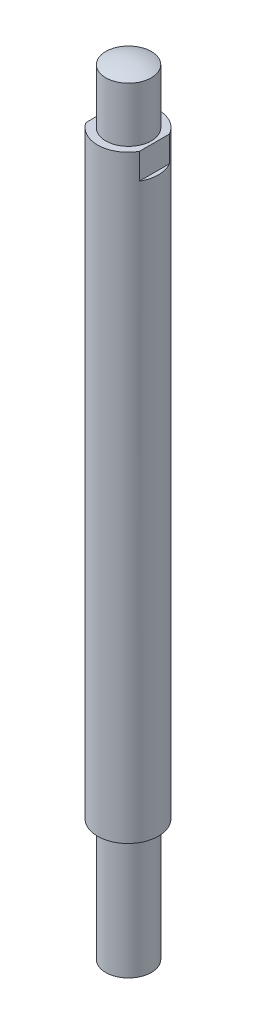
from build123d import *

# Parameters (mm, degrees)
SKETCH1_R           = 20
SKETCH1_R_2         = 15
BOSS_EXTRUDE1_DEPTH = 394
BOSS_EXTRUDE2_START = 394
SKETCH1_2_R         = 15
BOSS_EXTRUDE2_DEPTH = 36
SKETCH1_3_R         = 15
BOSS_EXTRUDE3_DEPTH = 80
CUT_EXTRUDE1_START  = 377
CUT_EXTRUDE1_DEPTH  = 17
DOME8_FACE_RADIUS   = 15
DOME8_HEIGHT        = 3
DOME9_FACE_RADIUS   = 15
DOME9_HEIGHT        = 3


with BuildPart() as part:
    # Sketch1 → Boss-Extrude1 (new body)
    with BuildSketch(Plane(origin=(0, 0, 0), x_dir=(1, 0, 0), z_dir=(0, 1, 0))):
        with Locations(Location((-0.371790911, 0, 0), (0, 0, 270))):
            Circle(SKETCH1_R)
        with Locations(Location((0, 0, 0), (0, 0, 270))):
            Circle(SKETCH1_R_2, mode=Mode.SUBTRACT)
    extrude(amount=BOSS_EXTRUDE1_DEPTH)

    # Sketch2 → Cut-Extrude1 (cut)
    with BuildSketch(Plane(origin=(0, 0, 0), x_dir=(1, 0, 0), z_dir=(0, 1, 0)).offset(CUT_EXTRUDE1_START)):
        with BuildLine():
            Line((-17, 11.113175176), (-17, -11.113175176))
            ThreePointArc((-17, -11.113175176), (-20.371790911, 0), (-17, 11.113175176))
        make_face()
        with BuildLine():
            ThreePointArc((17, -9.91064481), (19.628209089, 0), (17, 9.91064481))
            Line((17, 9.91064481), (17, -9.91064481))
        make_face()
    extrude(amount=CUT_EXTRUDE1_DEPTH, mode=Mode.SUBTRACT)


with BuildPart() as body_2:
    # Sketch1<2> → Boss-Extrude2 (new body)
    with BuildSketch(Plane(origin=(0, 0, 0), x_dir=(1, 0, 0), z_dir=(0, 1, 0)).offset(BOSS_EXTRUDE2_START)):
        with Locations(Location((0, 0, 0), (0, 0, 270))):
            Circle(SKETCH1_2_R)
    extrude(amount=BOSS_EXTRUDE2_DEPTH)

    # Dome8: a dome of height H over a round flat face of radius A is a cap of a sphere of radius (A * A + H * H) / (2 * H)
    dome8_r = (DOME8_FACE_RADIUS * DOME8_FACE_RADIUS + DOME8_HEIGHT * DOME8_HEIGHT) / (2 * DOME8_HEIGHT)
    dome8_base = Plane((0, 430, 0), z_dir=(0, 1, 0))
    with Locations(dome8_base.offset(DOME8_HEIGHT - dome8_r)):
        dome8_ball = Sphere(dome8_r, mode=Mode.PRIVATE)
    add(split(dome8_ball, bisect_by=dome8_base, keep=Keep.TOP, mode=Mode.PRIVATE))


with BuildPart() as body_3:
    # Sketch1<3> → Boss-Extrude3 (new body)
    with BuildSketch(Plane(origin=(0, 0, 0), x_dir=(1, 0, 0), z_dir=(0, 1, 0))):
        with Locations(Location((0, 0, 0), (0, 0, 270))):
            Circle(SKETCH1_3_R)
    extrude(amount=-BOSS_EXTRUDE3_DEPTH)

    # Dome9: a dome of height H over a round flat face of radius A is a cap of a sphere of radius (A * A + H * H) / (2 * H)
    dome9_r = (DOME9_FACE_RADIUS * DOME9_FACE_RADIUS + DOME9_HEIGHT * DOME9_HEIGHT) / (2 * DOME9_HEIGHT)
    dome9_base = Plane((0, -80, 0), z_dir=(0, -1, 0))
    with Locations(dome9_base.offset(DOME9_HEIGHT - dome9_r)):
        dome9_ball = Sphere(dome9_r, mode=Mode.PRIVATE)
    add(split(dome9_ball, bisect_by=dome9_base, keep=Keep.TOP, mode=Mode.PRIVATE))


solid = Compound([part.part, body_2.part, body_3.part])
